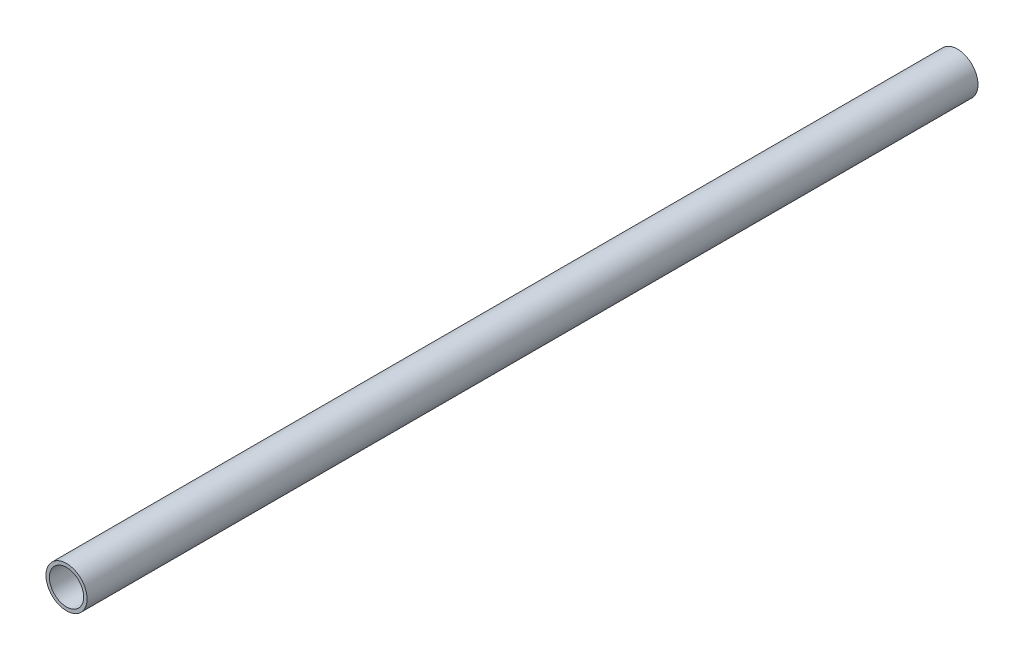
from build123d import *

# Parameters (mm, degrees)
ESQUISSE1_R        = 12
ESQUISSE1_R_2      = 10
BOSS_EXTRU_1_DEPTH = 520


with BuildPart() as part:
    # Esquisse1 → Boss.-Extru.1 (new body)
    with BuildSketch(Plane.XY):
        Circle(ESQUISSE1_R)
        Circle(ESQUISSE1_R_2, mode=Mode.SUBTRACT)
    extrude(amount=BOSS_EXTRU_1_DEPTH)


solid = part.part
